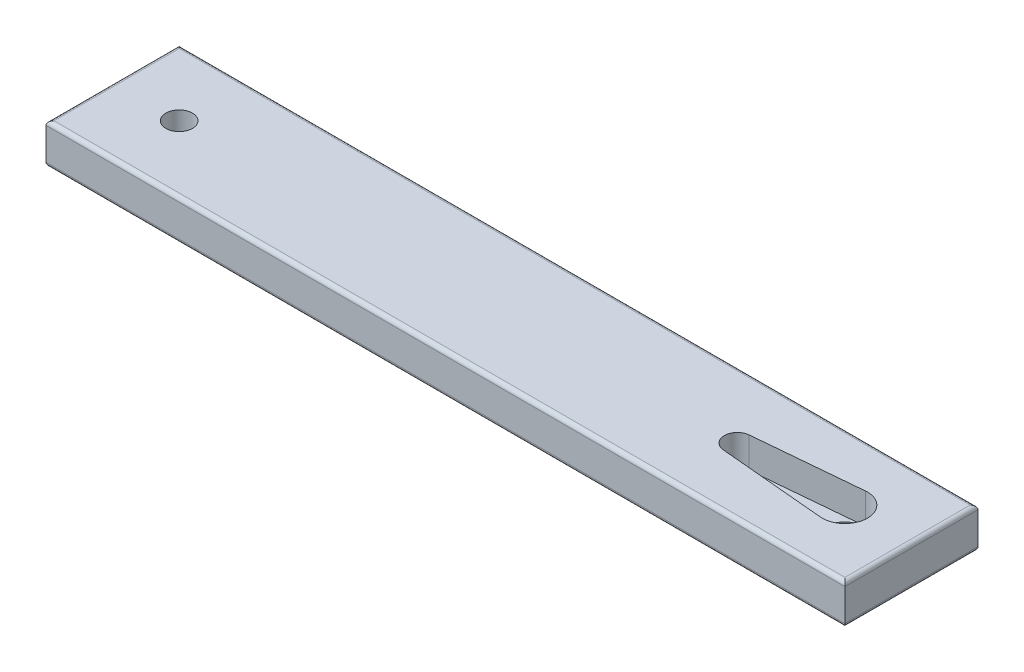
from build123d import *
from build123d.topology import SkipClean

# Parameters (mm, degrees)
SKETCH1_W           = 120
SKETCH1_H           = 20
BOSS_EXTRUDE1_DEPTH = 6
CUT_EXTRUDE1_DEPTH  = 4.6
SKETCH3_R           = 3.4
CUT_EXTRUDE2_DEPTH  = 4.6
SKETCH4_R           = 2
CUT_EXTRUDE3_DEPTH  = 122.803119829
FILLET1_R           = 0.6


with BuildPart() as part:
    # Sketch1 → Boss-Extrude1 (new body)
    with BuildSketch(Plane(origin=(0, 0, 0), x_dir=(1, 0, 0), z_dir=(0, 1, 0))):
        with Locations((60, 10)):
            Rectangle(SKETCH1_W, SKETCH1_H)
    extrude(amount=BOSS_EXTRUDE1_DEPTH)

    # Sketch2 → Cut-Extrude1 (cut)
    with BuildSketch(Plane(origin=(0, 6, 0), x_dir=(1, 0, 0), z_dir=(0, 1, 0))):
        with BuildLine():
            Line((93.674922601, 11.942124585), (109.694736842, 13.386268507))
            ThreePointArc((109.694736842, 13.386268507), (113.4, 10), (109.694736842, 6.613731493))
            Line((109.694736842, 6.613731493), (93.674922601, 8.057875415))
            ThreePointArc((93.674922601, 8.057875415), (91.9, 10), (93.674922601, 11.942124585))
        make_face()
    extrude(amount=-CUT_EXTRUDE1_DEPTH, mode=Mode.SUBTRACT)

    # Sketch3 → Cut-Extrude2 (cut)
    with SkipClean():  # the faces are left unmerged after this step: merging them gives an invalid solid
        with BuildSketch(Plane(origin=(0, 1.4, 0), x_dir=(1, 0, 0), z_dir=(0, 1, 0))):
            with Locations(Location((110, 10, 0), (0, 0, 264.848860425))):
                Circle(SKETCH3_R)
        extrude(amount=-CUT_EXTRUDE2_DEPTH, mode=Mode.SUBTRACT)

    # Sketch4 → Cut-Extrude3 (cut, through all)
    with SkipClean():  # the faces are left unmerged after this step: merging them gives an invalid solid
        with BuildSketch(Plane(origin=(0, 6, 0), x_dir=(1, 0, 0), z_dir=(0, 1, 0))):
            with Locations(Location((10, 10, 0), (0, 0, 270))):
                Circle(SKETCH4_R)
        extrude(amount=-CUT_EXTRUDE3_DEPTH, mode=Mode.SUBTRACT)

    # Fillet1
    fillet1_edges = [part.edges().sort_by_distance(p)[0] for p in [
        (120, 6, -10),
        (60, 6, -20),
        (0, 6, -10),
        (60, 0, -20),
        (120, 0, -10),
        (60, 0, 0),
        (0, 0, -10),
        (60, 6, 0),
    ]]
    fillet(fillet1_edges, radius=FILLET1_R)


solid = part.part
